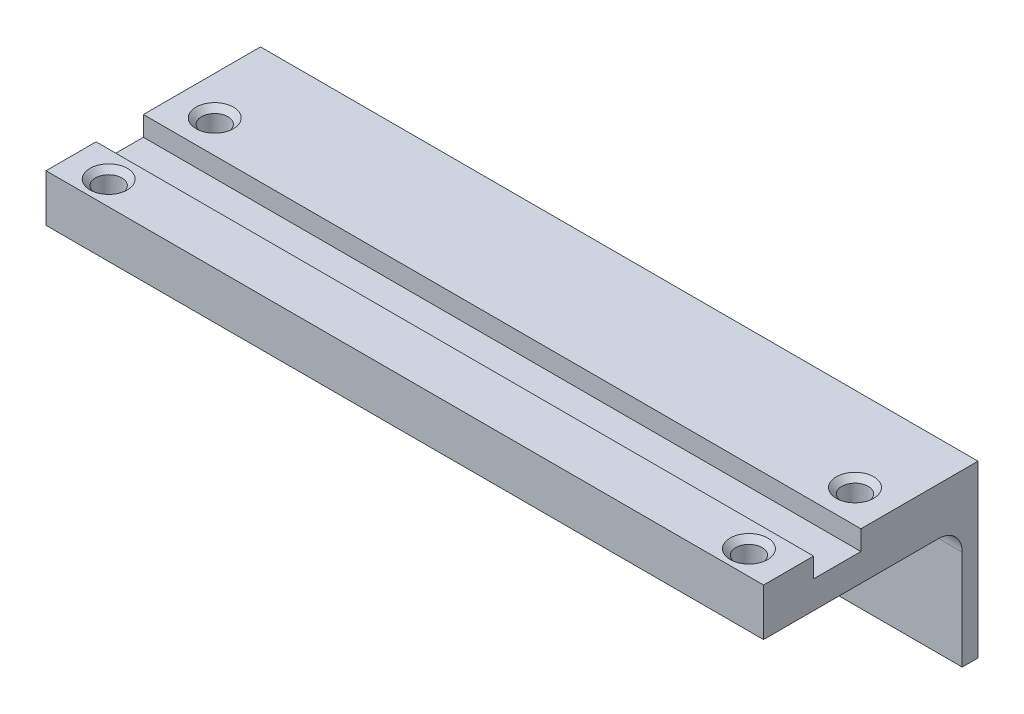
from build123d import *

# Parameters (mm, degrees)
SKETCH1_W           = 91
SKETCH1_H           = 24
BOSS_EXTRUDE1_DEPTH = 4
SKETCH2_R           = 1.675
CUT_EXTRUDE1_DEPTH  = 48.22552276
SKETCH3_W           = 91
SKETCH3_H           = 6
CUT_EXTRUDE2_DEPTH  = 2.5
SKETCH4_W           = 91
SKETCH4_H           = 4
BOSS_EXTRUDE2_DEPTH = 2.2
SKETCH5_W           = 91
SKETCH5_H           = 2
BOSS_EXTRUDE3_DEPTH = 17.62
SKETCH6_R           = 1.75
CUT_EXTRUDE3_DEPTH  = 55.464248824
SKETCH7_W           = 91
SKETCH7_H           = 24.2
SKETCH7_R           = 1.675
BOSS_EXTRUDE5_DEPTH = 2
SKETCH8_W           = 91
SKETCH8_H           = 6
BOSS_EXTRUDE6_DEPTH = 1
CHAMFER1_SIZE       = 0.7
FILLET1_R           = 3


with BuildPart() as part:
    # Sketch1 → Boss-Extrude1 (new body)
    with BuildSketch(Plane(origin=(0, 0, 0), x_dir=(1, 0, 0), z_dir=(0, 1, 0))):
        Rectangle(SKETCH1_W, SKETCH1_H)
    extrude(amount=BOSS_EXTRUDE1_DEPTH)

    # Sketch2 → Cut-Extrude1 (cut, through all)
    with BuildSketch(Plane(origin=(0, 4, 0), x_dir=(1, 0, 0), z_dir=(0, 1, 0))):
        with Locations(Location((-40.6, 3.5, 0), (0, 0, 270))):
            Circle(SKETCH2_R)
        with Locations(Location((-40.6, -9.95, 0), (0, 0, 270))):
            Circle(SKETCH2_R)
        with Locations(Location((40.6, 3.5, 0), (0, 0, 270))):
            Circle(SKETCH2_R)
        with Locations(Location((40.6, -9.95, 0), (0, 0, 270))):
            Circle(SKETCH2_R)
    extrude(amount=-CUT_EXTRUDE1_DEPTH, mode=Mode.SUBTRACT)

    # Sketch3 → Cut-Extrude2 (cut)
    with BuildSketch(Plane(origin=(0, 4, 0), x_dir=(1, 0, 0), z_dir=(0, 1, 0))):
        with Locations((0, -3.65)):
            Rectangle(SKETCH3_W, SKETCH3_H)
    extrude(amount=-CUT_EXTRUDE2_DEPTH, mode=Mode.SUBTRACT)

    # Sketch4 → Boss-Extrude2 (add)
    with BuildSketch(Plane(origin=(0, 0, -12), x_dir=(-1, 0, 0), z_dir=(0, 0, -1))):
        with Locations((0, 2)):
            Rectangle(SKETCH4_W, SKETCH4_H)
    extrude(amount=BOSS_EXTRUDE2_DEPTH)

    # Sketch5 → Boss-Extrude3 (add)
    with BuildSketch(Plane.XZ):
        with Locations((0, -13.2)):
            Rectangle(SKETCH5_W, SKETCH5_H)
    extrude(amount=BOSS_EXTRUDE3_DEPTH)

    # Sketch6 → Cut-Extrude3 (cut, through all)
    with BuildSketch(Plane.XY.offset(-12.2)):
        with Locations((-21.25, -10.12)):
            Circle(SKETCH6_R)
        with Locations((0, -10.12)):
            Circle(SKETCH6_R)
        with Locations((21.25, -10.12)):
            Circle(SKETCH6_R)
    extrude(amount=-CUT_EXTRUDE3_DEPTH, mode=Mode.SUBTRACT)

    # Sketch7 → Boss-Extrude5 (add)
    with BuildSketch(Plane.XZ):
        with Locations((0, -0.1)):
            Rectangle(SKETCH7_W, SKETCH7_H)
        with Locations(Location((40.6, 9.95, 0), (0, 0, 90))):
            Circle(SKETCH7_R, mode=Mode.SUBTRACT)
        with Locations(Location((40.6, -3.5, 0), (0, 0, 90))):
            Circle(SKETCH7_R, mode=Mode.SUBTRACT)
        with Locations(Location((-40.6, -3.5, 0), (0, 0, 90))):
            Circle(SKETCH7_R, mode=Mode.SUBTRACT)
        with Locations(Location((-40.6, 9.95, 0), (0, 0, 90))):
            Circle(SKETCH7_R, mode=Mode.SUBTRACT)
    extrude(amount=BOSS_EXTRUDE5_DEPTH)

    # Sketch8 → Boss-Extrude6 (add)
    with BuildSketch(Plane.XY.offset(12)):
        with Locations((0, 1)):
            Rectangle(SKETCH8_W, SKETCH8_H)
    extrude(amount=BOSS_EXTRUDE6_DEPTH)

    # Chamfer1
    chamfer1_edges = [part.edges().sort_by_distance(p)[0] for p in [
        (40.6, 4, 8.275),
        (-40.6, 4, -5.175),
        (40.6, 4, -5.175),
        (-40.6, 4, 8.275),
    ]]
    chamfer(chamfer1_edges, length=CHAMFER1_SIZE)

    # Fillet1
    fillet1_edges = [part.edges().sort_by_distance(p)[0] for p in [
        (0, -2, -12.2),
    ]]
    fillet(fillet1_edges, radius=FILLET1_R)


solid = part.part
